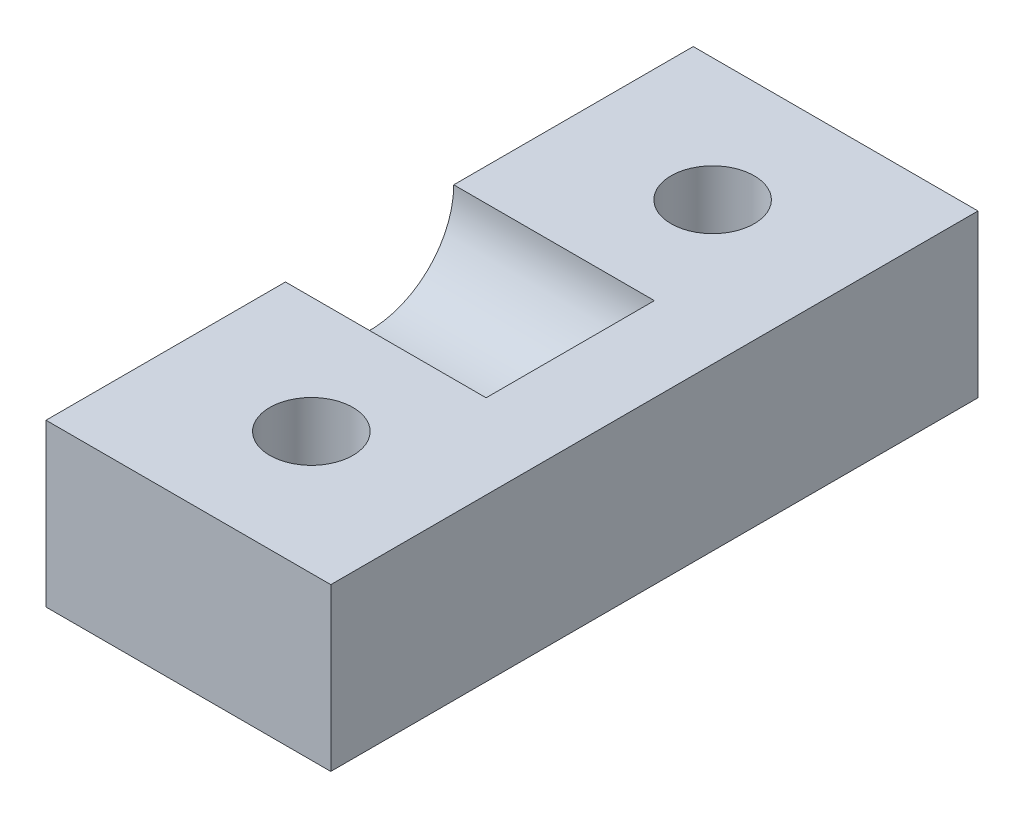
from build123d import *

# Parameters (mm, degrees)
SKETCH1_W           = 11.176
SKETCH1_H           = 25.4
BOSS_EXTRUDE1_DEPTH = 6.35
SKETCH2_R           = 3.302
CUT_EXTRUDE1_DEPTH  = 7.874
CUT_EXTRUDE2_REACH  = 17.259
SKETCH3_R           = 1.63195


with BuildPart() as part:
    # Sketch1 → Boss-Extrude1 (new body)
    with BuildSketch(Plane(origin=(0, 0, 0), x_dir=(1, 0, 0), z_dir=(0, 1, 0))):
        Rectangle(SKETCH1_W, SKETCH1_H)
    extrude(amount=-BOSS_EXTRUDE1_DEPTH)

    # Sketch2 → Cut-Extrude1 (cut)
    with BuildSketch(Plane.ZY.offset(5.588)):
        Circle(SKETCH2_R)
    extrude(amount=-CUT_EXTRUDE1_DEPTH, mode=Mode.SUBTRACT)

    # Sketch3 → Cut-Extrude2 (cut, up to next)
    with BuildSketch(Plane(origin=(0, 0, 0), x_dir=(1, 0, 0), z_dir=(0, 1, 0)), mode=Mode.PRIVATE) as cut_extrude2_sk1:
        with Locations(Location((0, 7.874, 0), (0, 0, 270))):
            Circle(SKETCH3_R)
    cut_extrude2_tool1 = extrude(cut_extrude2_sk1.sketch, amount=-CUT_EXTRUDE2_REACH, mode=Mode.PRIVATE) & part.part
    # Sketch3 → Cut-Extrude2 (cut, up to next)
    with BuildSketch(Plane(origin=(0, 0, 0), x_dir=(1, 0, 0), z_dir=(0, 1, 0)), mode=Mode.PRIVATE) as cut_extrude2_sk2:
        with Locations(Location((0, -7.874, 0), (0, 0, 270))):
            Circle(SKETCH3_R)
    cut_extrude2_tool2 = extrude(cut_extrude2_sk2.sketch, amount=-CUT_EXTRUDE2_REACH, mode=Mode.PRIVATE) & part.part
    add(cut_extrude2_tool1.solids().sort_by_distance((0, 0, -7.874))[0], mode=Mode.SUBTRACT)
    add(cut_extrude2_tool2.solids().sort_by_distance((0, 0, 7.874))[0], mode=Mode.SUBTRACT)


solid = part.part
